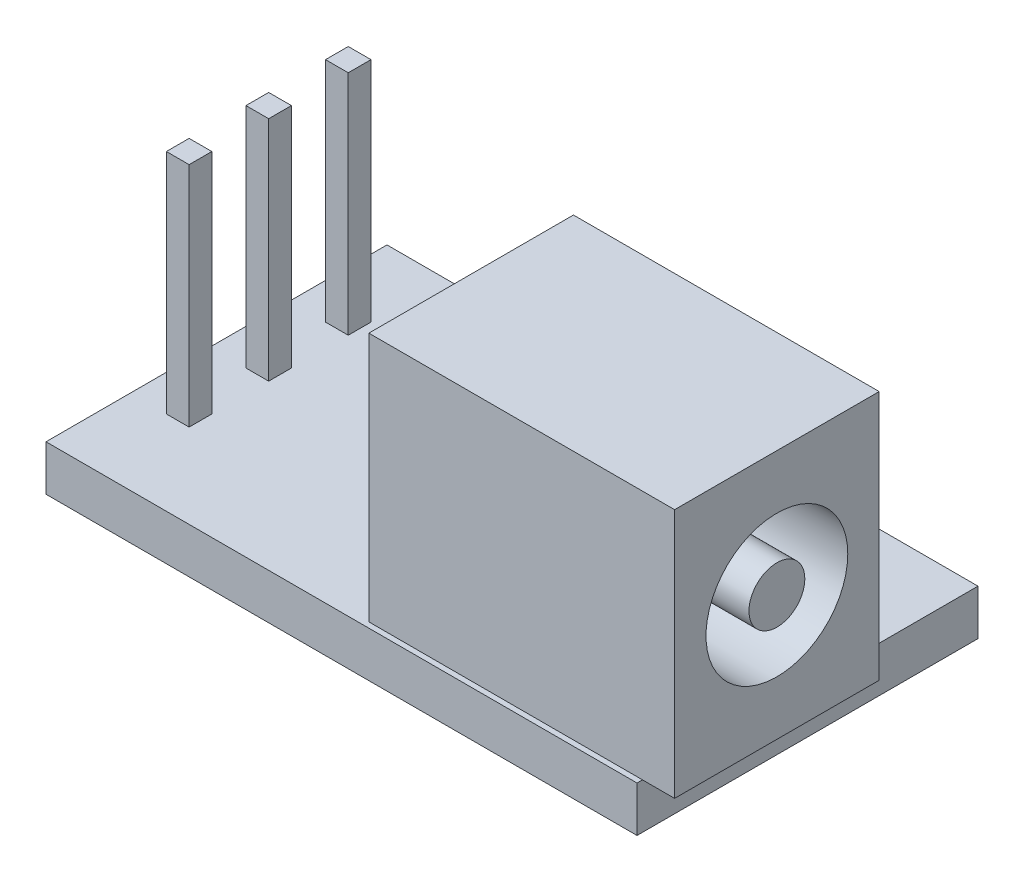
from build123d import *

# Parameters (mm, degrees)
SKETCH1_W           = 26
SKETCH1_H           = 15
BOSS_EXTRUDE1_DEPTH = 2
SKETCH2_W           = 13.45020195
SKETCH2_H           = 9
BOSS_EXTRUDE2_DEPTH = 11
SKETCH3_R           = 1.5
CUT_EXTRUDE1_DEPTH  = 11
SKETCH4_W           = 1
SKETCH4_H           = 1
BOSS_EXTRUDE3_DEPTH = 10
SKETCH5_R           = 3.118355213
SKETCH5_R_2         = 1.2290481
CUT_EXTRUDE2_DEPTH  = 10


with BuildPart() as part:
    # Sketch1 → Boss-Extrude1 (new body)
    with BuildSketch(Plane(origin=(0, 0, 0), x_dir=(1, 0, 0), z_dir=(0, 1, 0))):
        Rectangle(SKETCH1_W, SKETCH1_H)
    extrude(amount=BOSS_EXTRUDE1_DEPTH)

    # Sketch2 → Boss-Extrude2 (add)
    with BuildSketch(Plane(origin=(0, 2, 0), x_dir=(1, 0, 0), z_dir=(0, 1, 0))):
        with Locations((7.687739683, -2.759900257)):
            Rectangle(SKETCH2_W, SKETCH2_H)
    extrude(amount=BOSS_EXTRUDE2_DEPTH)

    # Sketch3 → Cut-Extrude1 (cut)
    with BuildSketch(Plane(origin=(0, 2, 0), x_dir=(1, 0, 0), z_dir=(0, 1, 0))):
        with Locations(Location((-4, 0, 0), (0, 0, 270))):
            Circle(SKETCH3_R)
    extrude(amount=-CUT_EXTRUDE1_DEPTH, mode=Mode.SUBTRACT)

    # Sketch4 → Boss-Extrude3 (add)
    with BuildSketch(Plane(origin=(0, 2, 0), x_dir=(1, 0, 0), z_dir=(0, 1, 0))):
        with Locations((-10.910563353, -3.293392003)):
            Rectangle(SKETCH4_W, SKETCH4_H)
        with Locations((-10.910563353, 0.206607997)):
            Rectangle(SKETCH4_W, SKETCH4_H)
        with Locations((-10.910563353, 3.706607997)):
            Rectangle(SKETCH4_W, SKETCH4_H)
    extrude(amount=BOSS_EXTRUDE3_DEPTH)

    # Sketch5 → Cut-Extrude2 (cut)
    with BuildSketch(Plane(origin=(14.412840658, 0, 0), x_dir=(0, 0, -1), z_dir=(1, 0, 0))):
        with Locations((-2.759900257, 7.5)):
            Circle(SKETCH5_R)
        with Locations((-2.759900257, 7.5)):
            Circle(SKETCH5_R_2, mode=Mode.SUBTRACT)
    extrude(amount=-CUT_EXTRUDE2_DEPTH, mode=Mode.SUBTRACT)


solid = part.part
